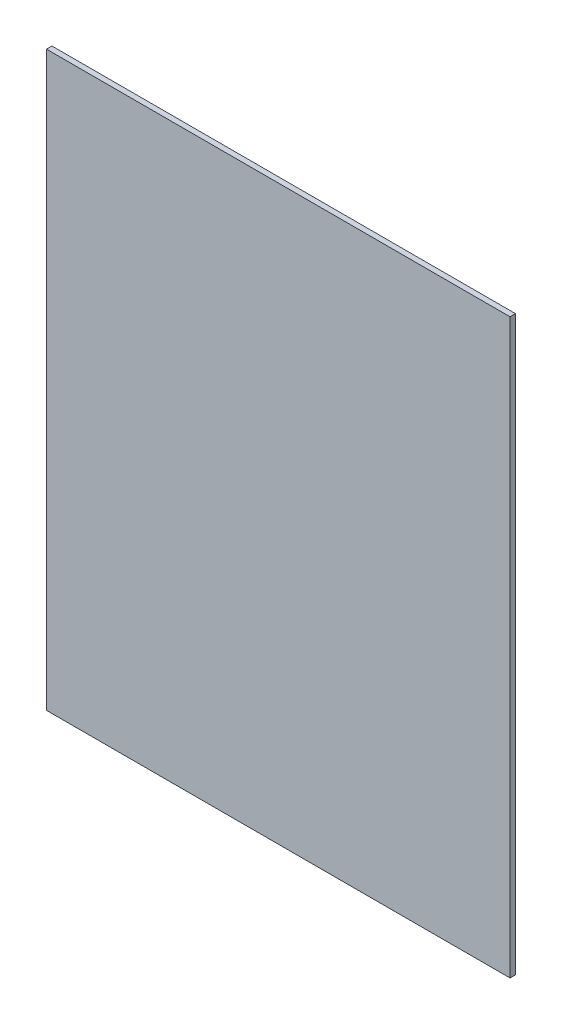
from build123d import *

# Parameters (mm, degrees)
SKETCH1_W           = 170
SKETCH1_H           = 210
BOSS_EXTRUDE1_DEPTH = 2


with BuildPart() as part:
    # Sketch1 → Boss-Extrude1 (new body)
    with BuildSketch(Plane.XY):
        Rectangle(SKETCH1_W, SKETCH1_H)
    extrude(amount=BOSS_EXTRUDE1_DEPTH)


solid = part.part
